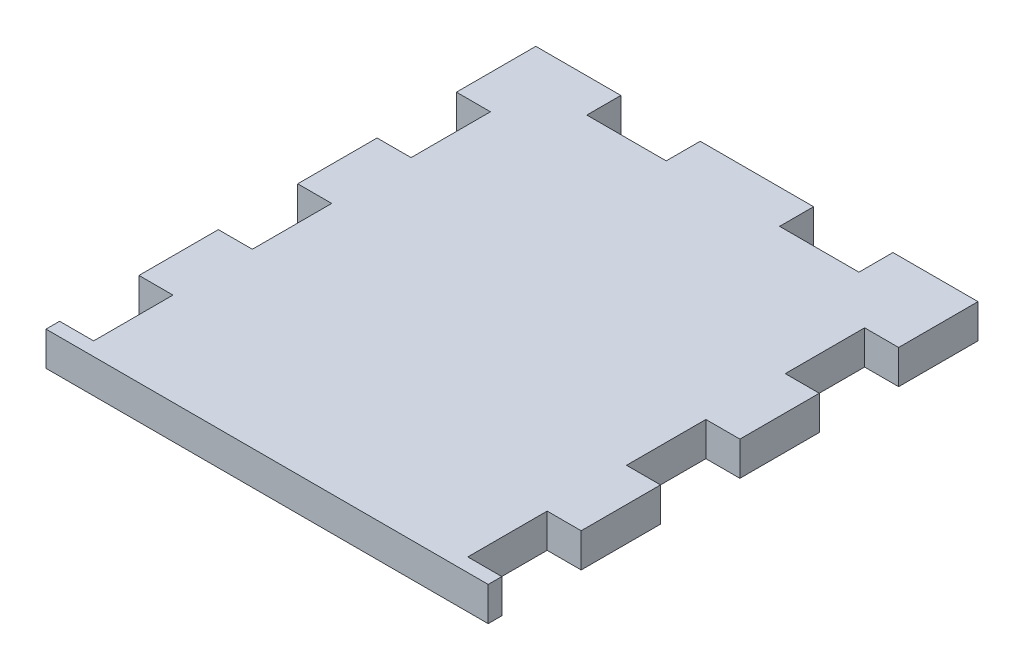
from build123d import *

# Parameters (mm, degrees)
SKETCH1_W           = 3
SKETCH1_H           = 7
BOSS_EXTRUDE1_DEPTH = 3


with BuildPart() as part:
    # Sketch1 → Boss-Extrude1 (new body)
    with BuildSketch(Plane(origin=(0, 0, 0), x_dir=(1, 0, 0), z_dir=(0, 1, 0))):
        Polygon((0, 35), (0, 28), (0, 21), (0, 14), (0, 7), (0, 0), (33, 0), (33, 7), (33, 14), (33, 21), (33, 28), (33, 35), (33, 42), (28.5, 42), (28.5, 39), (21.5, 39), (21.5, 42), (11.5, 42), (11.5, 39), (4.5, 39), (4.5, 42), (0, 42), align=None)
        with Locations((-1.5, 38.5)):
            Rectangle(SKETCH1_W, SKETCH1_H)
        with Locations((-1.5, 24.5)):
            Rectangle(SKETCH1_W, SKETCH1_H)
        with Locations((-1.5, 10.5)):
            Rectangle(SKETCH1_W, SKETCH1_H)
        with Locations((34.5, 10.5)):
            Rectangle(SKETCH1_W, SKETCH1_H)
        with Locations((34.5, 24.5)):
            Rectangle(SKETCH1_W, SKETCH1_H)
        with Locations((34.5, 38.5)):
            Rectangle(SKETCH1_W, SKETCH1_H)
        Polygon((33, 0), (0, 0), (-3, 0), (-3, -1.2), (36, -1.2), (36, 0), align=None)
    extrude(amount=BOSS_EXTRUDE1_DEPTH)


solid = part.part
